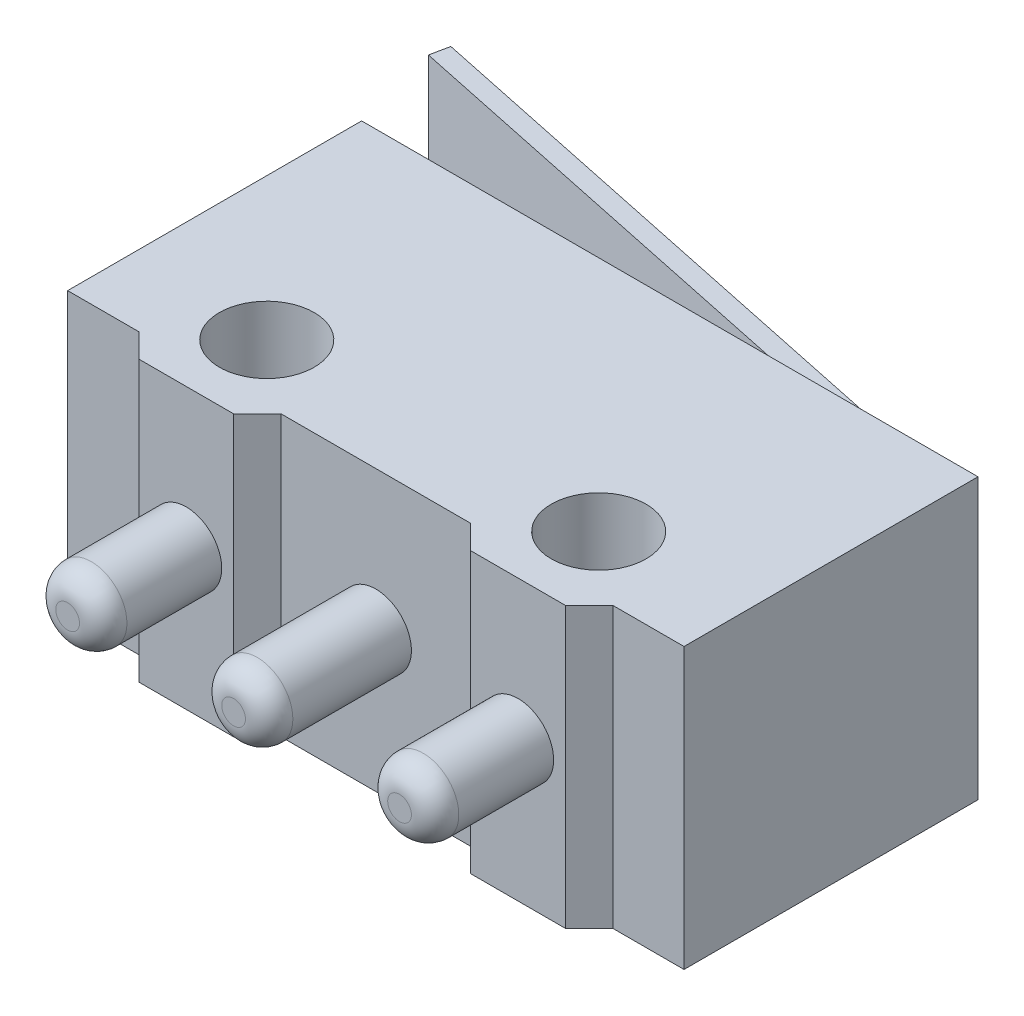
from build123d import *

# Parameters (mm, degrees)
SKETCH1_R           = 1
BOSS_EXTRUDE1_DEPTH = 2.95
CUT_EXTRUDE1_DEPTH  = 0.5
SKETCH3_R           = 0.75
BOSS_EXTRUDE2_DEPTH = 3
FILLET1_R           = 0.5


with BuildPart() as part:
    # Sketch1 → Boss-Extrude1 (new, symmetric)
    with BuildSketch(Plane(origin=(0, 0, 0), x_dir=(1, 0, 0), z_dir=(0, 1, 0))):
        Polygon((-6.5, -3.1), (-5, -3.1), (-4.5, -3.6), (-2.5, -3.6), (-2, -3.1), (2, -3.1), (2.5, -3.6), (4.5, -3.6), (5, -3.1), (6.5, -3.1), (6.5, 3.1), (5.9, 3.1), (-7.417700692, 5.9), (-7.5, 5.50855802), (3.955876716, 3.1), (-6.5, 3.1), align=None)
        with Locations(Location((3.5, -1.9, 0), (0, 0, 270))):
            Circle(SKETCH1_R, mode=Mode.SUBTRACT)
        with Locations(Location((-3.5, -1.9, 0), (0, 0, 90))):
            Circle(SKETCH1_R, mode=Mode.SUBTRACT)
    extrude(amount=BOSS_EXTRUDE1_DEPTH, both=True)

    # Sketch2 → Cut-Extrude1 (cut)
    with BuildSketch(Plane(origin=(0, 2.95, 0), x_dir=(1, 0, 0), z_dir=(0, 1, 0))):
        Polygon((5.9, 3.1), (3.955876716, 3.1), (-7.5, 5.50855802), (-7.417700692, 5.9), align=None)
    cut_extrude1 = extrude(amount=-CUT_EXTRUDE1_DEPTH, mode=Mode.SUBTRACT)

    # Mirror1: Cut-Extrude1 across plane
    add(cut_extrude1.mirror(Plane.ZX), mode=Mode.SUBTRACT)

    # Sketch3 → Boss-Extrude2 (add)
    with BuildSketch(Plane.XY.offset(3.1)):
        with Locations(Location((0, 0, 0), (0, 0, 180))):
            Circle(SKETCH3_R)
        with Locations(Location((-3.5, 0, 0), (0, 0, 180))):
            Circle(SKETCH3_R)
        with Locations(Location((3.5, 0, 0), (0, 0, 180))):
            Circle(SKETCH3_R)
    extrude(amount=BOSS_EXTRUDE2_DEPTH)

    # Fillet1
    fillet1_edges = [part.edges().sort_by_distance(p)[0] for p in [
        (0.75, 0, 6.1),
        (-2.75, 0, 6.1),
        (4.25, 0, 6.1),
    ]]
    fillet(fillet1_edges, radius=FILLET1_R)


solid = part.part
